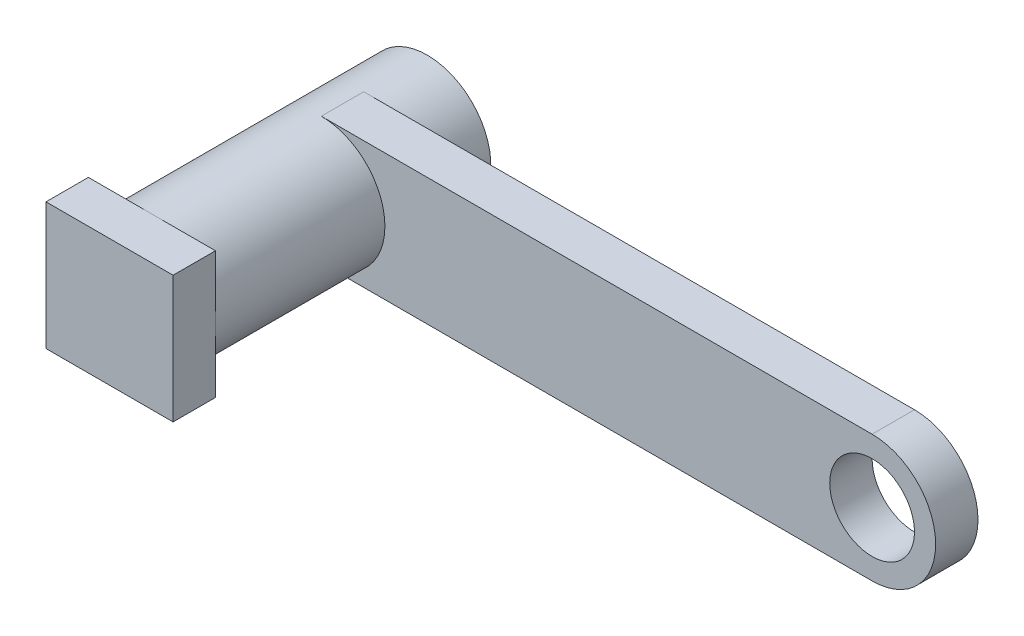
from build123d import *

# Parameters (mm, degrees)
CROQUIS1_R              = 10
SALIENTE_EXTRUIR1_DEPTH = 10
CROQUIS2_R              = 15
CROQUIS2_R_2            = 10
SALIENTE_EXTRUIR2_DEPTH = 40
CROQUIS3_W              = 30
CROQUIS3_H              = 30
SALIENTE_EXTRUIR3_DEPTH = 10
BOSS_EXTRUDE1_START     = 15
SKETCH1_R               = 15
SKETCH1_R_2             = 10
BOSS_EXTRUDE1_DEPTH     = 15


with BuildPart() as part:
    # Croquis1 → Saliente-Extruir1 (new body)
    with BuildSketch(Plane.XY):
        with BuildLine():
            Line((-44.292513238, 22.5), (85.707486762, 22.5))
            ThreePointArc((85.707486762, 22.5), (100.707486762, 7.5), (85.707486762, -7.5))
            Line((85.707486762, -7.5), (-44.292513238, -7.5))
            ThreePointArc((-44.292513238, -7.5), (-59.292513238, 7.5), (-44.292513238, 22.5))
        make_face()
        with Locations((-44.292513238, 7.5)):
            Circle(CROQUIS1_R, mode=Mode.SUBTRACT)
        with Locations(Location((85.707486762, 7.5, 0), (0, 0, 180))):
            Circle(CROQUIS1_R, mode=Mode.SUBTRACT)
    extrude(amount=SALIENTE_EXTRUIR1_DEPTH)

    # Croquis2 → Saliente-Extruir2 (add)
    with BuildSketch(Plane.XY.offset(10)):
        with Locations(Location((-44.292513238, 7.5, 0), (0, 0, 270))):
            Circle(CROQUIS2_R)
        with Locations((-44.292513238, 7.5)):
            Circle(CROQUIS2_R_2, mode=Mode.SUBTRACT)
    extrude(amount=SALIENTE_EXTRUIR2_DEPTH)

    # Croquis3 → Saliente-Extruir3 (add)
    with BuildSketch(Plane.XY.offset(50)):
        with Locations((-44.292513238, 7.5)):
            Rectangle(CROQUIS3_W, CROQUIS3_H)
    extrude(amount=SALIENTE_EXTRUIR3_DEPTH)

    # Sketch1 → Boss-Extrude1 (add)
    with BuildSketch(Plane(origin=(0, 0, 0), x_dir=(-1, 0, 0), z_dir=(0, 0, -1)).offset(BOSS_EXTRUDE1_START)):
        with Locations((44.292513238, 7.5)):
            Circle(SKETCH1_R)
        with Locations((44.292513238, 7.5)):
            Circle(SKETCH1_R_2, mode=Mode.SUBTRACT)
    extrude(amount=-BOSS_EXTRUDE1_DEPTH)


solid = part.part
